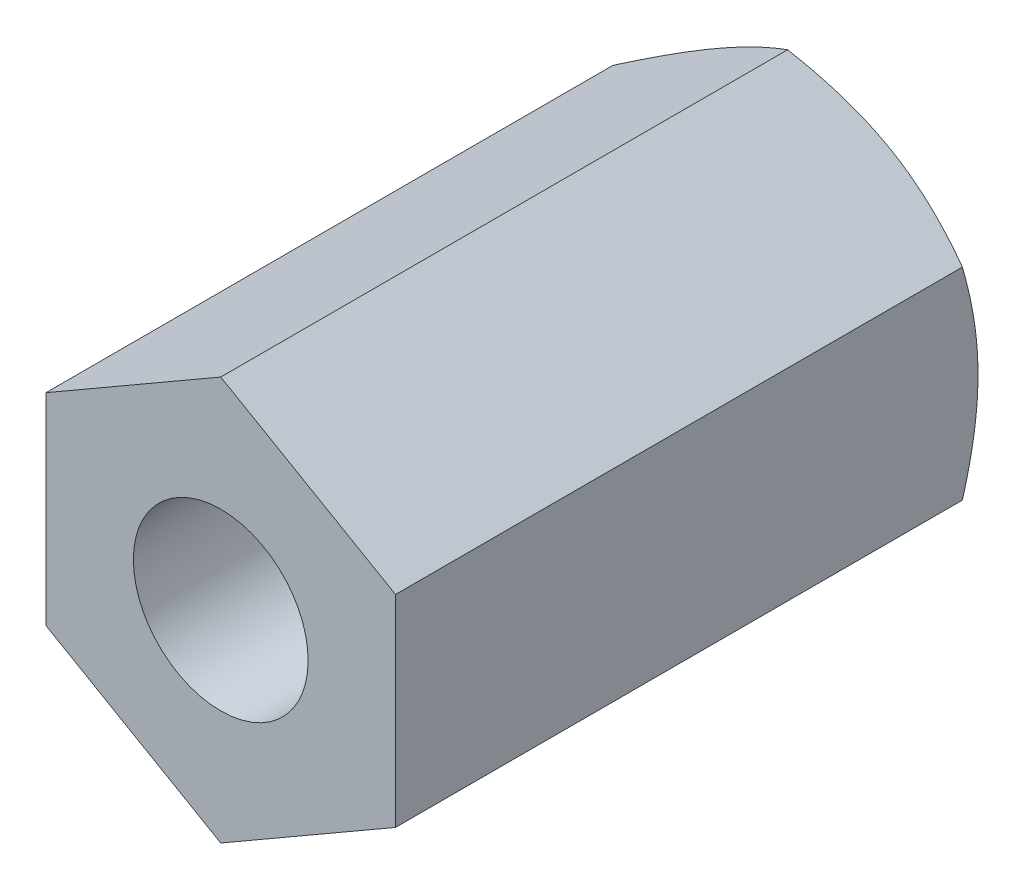
from build123d import *

# Parameters (mm, degrees)
EXTRUDE1_DEPTH      = 5
EXTRUDE1_DEPTH_BACK = 5
SKETCH1_R           = 1.5
SKETCH8_OUTSIDE_W   = 52.282
SKETCH8_OUTSIDE_H   = 53.21
SKETCH8_OUTSIDE_R   = 3
EXTRUDE4_DEPTH      = 12
EXTRUDE4_DRAFT      = -60


with BuildPart() as part:
    # Sketch1 → Extrude1 (new, two sides: drawn at the far end of the back side and taken through both)
    with BuildSketch(Plane.XY.offset(-EXTRUDE1_DEPTH_BACK)):
        Polygon((0, 3.464101615), (-3, 1.732050808), (-3, -1.732050808), (0, -3.464101615), (3, -1.732050808), (3, 1.732050808), align=None)
        Circle(SKETCH1_R, mode=Mode.SUBTRACT)
    extrude(amount=EXTRUDE1_DEPTH + EXTRUDE1_DEPTH_BACK)

    # Extrude3 cone 1 section (through the dimple's axis) → Extrude3 (revolve, cut)
    with BuildSketch(Plane(origin=(0, 0, -5), x_dir=(0, 1, 0), z_dir=(1, 0, 0))):
        Polygon((0, 0), (1.5508, 0), (0, 1.663029396), align=None)
    revolve(axis=Axis((0, 0, -5), (0, 0, 1)), mode=Mode.SUBTRACT)


with BuildPart() as extrude4_tool:
    # Sketch8 outside → Extrude4 (with draft: the straight prism first)
    with BuildSketch(Plane(origin=(0, 0, -5), x_dir=(-1, 0, 0), z_dir=(0, 0, -1))):
        Rectangle(SKETCH8_OUTSIDE_W, SKETCH8_OUTSIDE_H)
        Circle(SKETCH8_OUTSIDE_R, mode=Mode.SUBTRACT)
    extrude(amount=-EXTRUDE4_DEPTH)
    # Extrude4: the draft: its side faces are tilted about the plane it starts from
    extrude4_sides = [extrude4_tool.faces().sort_by_distance(p)[0] for p in [
        (0, -26.605, 1),
        (-26.141, 0, 1),
        (0, 26.605, 1),
        (26.141, 0, 1),
        (3, 0, 1),
    ]]
    draft(extrude4_sides, Plane(origin=(0, 0, -5), x_dir=(-1, 0, 0), z_dir=(0, 0, -1)), EXTRUDE4_DRAFT)


with BuildPart() as part_1:
    add(part.part)

    # Extrude4: cut by extrude4_tool
    add(extrude4_tool.part, mode=Mode.SUBTRACT)


solid = part_1.part
